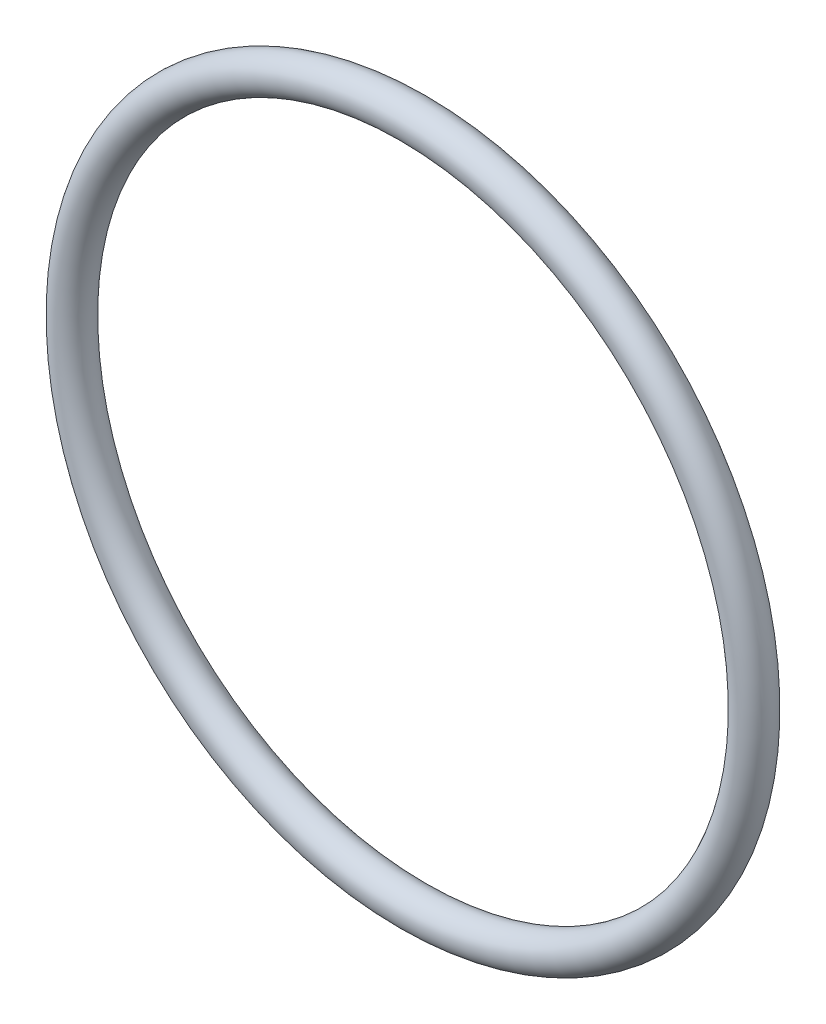
from build123d import *

# Parameters (mm, degrees)
SKETCH2_R = 0.889


with BuildPart() as part:
    # Sketch2 → Revolve1 (revolve)
    with BuildSketch(Plane(origin=(0, 0, 0), x_dir=(0, 0, -1), z_dir=(1, 0, 0)), mode=Mode.PRIVATE) as revolve1_sk:
        with Locations((0, 16.6243)):
            Circle(SKETCH2_R)
    revolve(revolve1_sk.sketch.rotate(Axis((0, 0, 15.7353), (0, 0, -1)), 180), axis=Axis((0, 0, 15.7353), (0, 0, -1)))


solid = part.part
